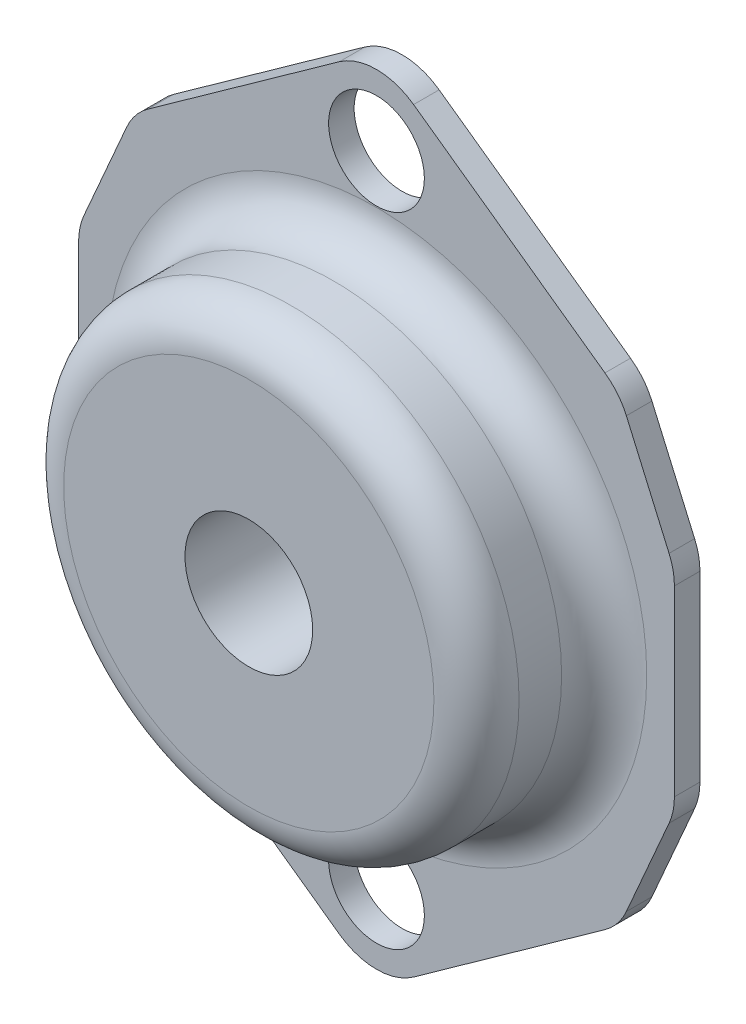
from build123d import *

# Parameters (mm, degrees)
SKETCH_1_R          = 2.25
SKETCH_1_R_2        = 3
EXTRUDE_1_DEPTH     = 1.2
FILLET_1_R          = 3
SKETCH_2_R          = 10.7
EXTRUDE_2_DEPTH     = 6
SKETCH_1_3_R        = 3
CUT_EXTRUDE_1_DEPTH = 20
FILLET_2_R          = 2


with BuildPart() as part:
    # ｽｹｯﾁ1 → ﾎﾞｽ - 押し出し1 (new body)
    with BuildSketch(Plane.XY):
        Polygon((-11.411313878, -10.847751594), (0, -19), (11.411313878, -10.847751594), (14, -4.917243675), (14, 4.917243675), (11.411313878, 10.847751594), (0, 19), (-11.411313878, 10.847751594), (-14, 4.917243675), (-14, -4.917243675), align=None)
        with Locations((0, 15)):
            Circle(SKETCH_1_R, mode=Mode.SUBTRACT)
        Circle(SKETCH_1_R_2, mode=Mode.SUBTRACT)
        with Locations((0, -15)):
            Circle(SKETCH_1_R, mode=Mode.SUBTRACT)
    extrude(amount=EXTRUDE_1_DEPTH)

    # ﾌｨﾚｯﾄ1
    fillet_1_edges = [part.edges().sort_by_distance(p)[0] for p in [
        (-14, -4.917243675, 0.6),
        (-11.411313878, -10.847751594, 0.6),
        (0, -19, 0.6),
        (11.411313878, -10.847751594, 0.6),
        (14, -4.917243675, 0.6),
        (14, 4.917243675, 0.6),
        (11.411313878, 10.847751594, 0.6),
        (-14, 4.917243675, 0.6),
        (-11.411313878, 10.847751594, 0.6),
        (0, 19, 0.6),
    ]]
    fillet(fillet_1_edges, radius=FILLET_1_R)

    # ｽｹｯﾁ2 → ﾎﾞｽ - 押し出し2 (add)
    with BuildSketch(Plane.XY.offset(1.2)):
        Circle(SKETCH_2_R)
    extrude(amount=EXTRUDE_2_DEPTH)

    # ｽｹｯﾁ1<3> → ｶｯﾄ - 押し出し1 (cut)
    with BuildSketch(Plane.XY):
        Circle(SKETCH_1_3_R)
    extrude(amount=CUT_EXTRUDE_1_DEPTH, mode=Mode.SUBTRACT)

    # ﾌｨﾚｯﾄ2
    fillet_2_edges = [part.edges().sort_by_distance(p)[0] for p in [
        (-10.7, 0, 7.2),
        (-10.7, 0, 1.2),
    ]]
    fillet(fillet_2_edges, radius=FILLET_2_R)


solid = part.part
